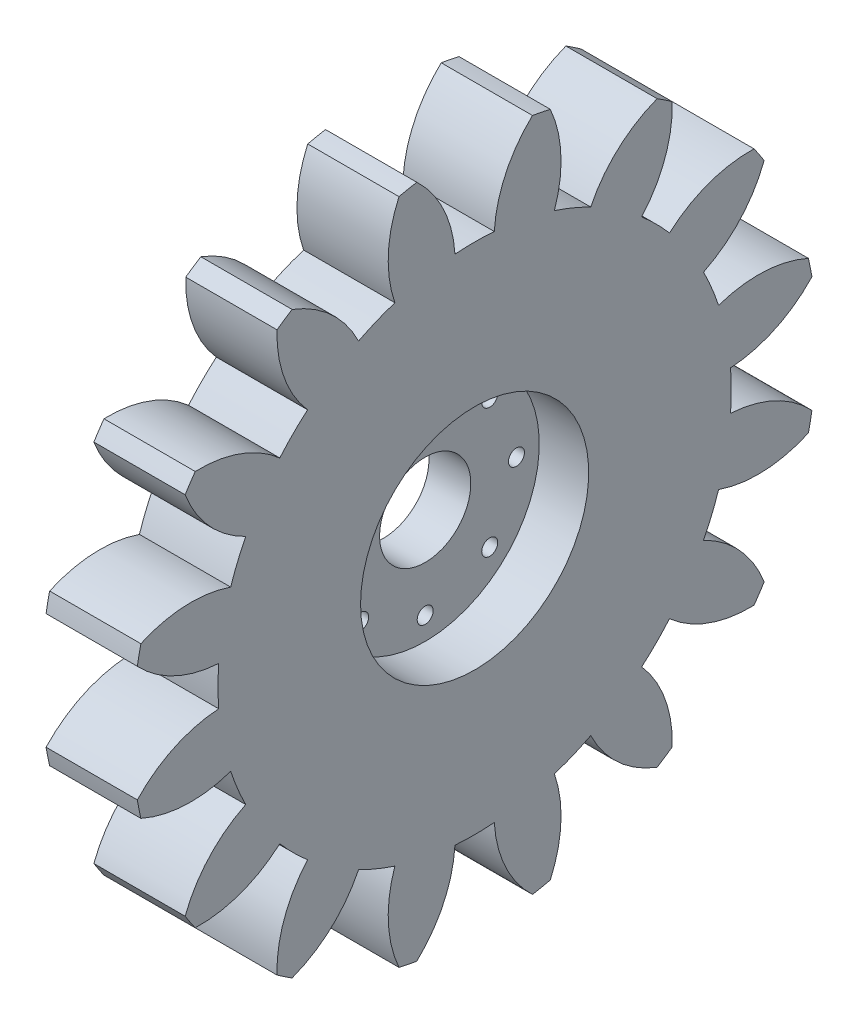
from build123d import *

# Parameters (mm, degrees)
TOOTHCUT_DEPTH     = 65.761099435
TEETHCUTS_COUNT    = 16
TEETHCUTS_ANGLE    = 337.5
BORSKE_R           = 6
BORE_DEPTH         = 50.0000508
SKETCH1_R          = 1.05
CUT_EXTRUDE1_DEPTH = 120


with BuildPart() as part:
    # BasProSke → Base-Revolve (revolve)
    with BuildSketch(Plane(origin=(0, 0, 0), x_dir=(1, 0, 0), z_dir=(0, 1, 0)), mode=Mode.PRIVATE) as base_revolve_sk:
        Polygon((0, 0), (0, 45), (12, 45), (12, 15), (5.5, 15), (5.5, 6), (4, 6), (4, 0), align=None)
    revolve(base_revolve_sk.sketch.rotate(Axis((-10, 0, 0), (1, 0, 0)), 180), axis=Axis((-10, 0, 0), (1, 0, 0)))

    # TooCutSke → ToothCut (cut, through all)
    with BuildSketch(Plane(origin=(0, 0, 0), x_dir=(0, 0, -1), z_dir=(1, 0, 0))):
        with BuildLine():
            ThreePointArc((2.585211293, 33.64983928), (0, 33.749), (-2.585211293, 33.64983928))
            ThreePointArc((-2.585211293, 33.64983928), (-4.077113604, 39.496303475), (-7.62816215, 44.37451732))
            ThreePointArc((-7.62816215, 44.37451732), (0, 45.0254), (7.62816215, 44.37451732))
            ThreePointArc((7.62816215, 44.37451732), (4.077113604, 39.496303475), (2.585211293, 33.64983928))
        make_face()
    toothcut = extrude(amount=TOOTHCUT_DEPTH, mode=Mode.SUBTRACT)

    # TeethCuts: ToothCut ×16 about axis
    teethcuts_axis = Axis((-10, 0, 0), (1, 0, 0))
    for i in range(1, TEETHCUTS_COUNT):
        add(toothcut.rotate(teethcuts_axis, i * TEETHCUTS_ANGLE / (TEETHCUTS_COUNT - 1)), mode=Mode.SUBTRACT)

    # BorSke → Bore (cut, symmetric)
    with BuildSketch(Plane(origin=(0, 0, 0), x_dir=(0, 0, -1), z_dir=(1, 0, 0))):
        with Locations(Location((0, 0, 0), (0, 0, 180))):
            Circle(BORSKE_R)
    extrude(amount=BORE_DEPTH, both=True, mode=Mode.SUBTRACT)

    # Sketch1 → Cut-Extrude1 (cut)
    with BuildSketch(Plane(origin=(12, 0, 0), x_dir=(0, 0, -1), z_dir=(1, 0, 0))):
        with Locations((0, 12)):
            Circle(SKETCH1_R)
        with Locations((8.485281374, 8.485281374)):
            Circle(SKETCH1_R)
        with Locations((12, 0)):
            Circle(SKETCH1_R)
        with Locations((8.485281374, -8.485281374)):
            Circle(SKETCH1_R)
        with Locations((0, -12)):
            Circle(SKETCH1_R)
        with Locations((-8.485281374, -8.485281374)):
            Circle(SKETCH1_R)
        with Locations((-12, 0)):
            Circle(SKETCH1_R)
        with Locations((-8.485281374, 8.485281374)):
            Circle(SKETCH1_R)
    extrude(amount=-CUT_EXTRUDE1_DEPTH, mode=Mode.SUBTRACT)


solid = part.part
